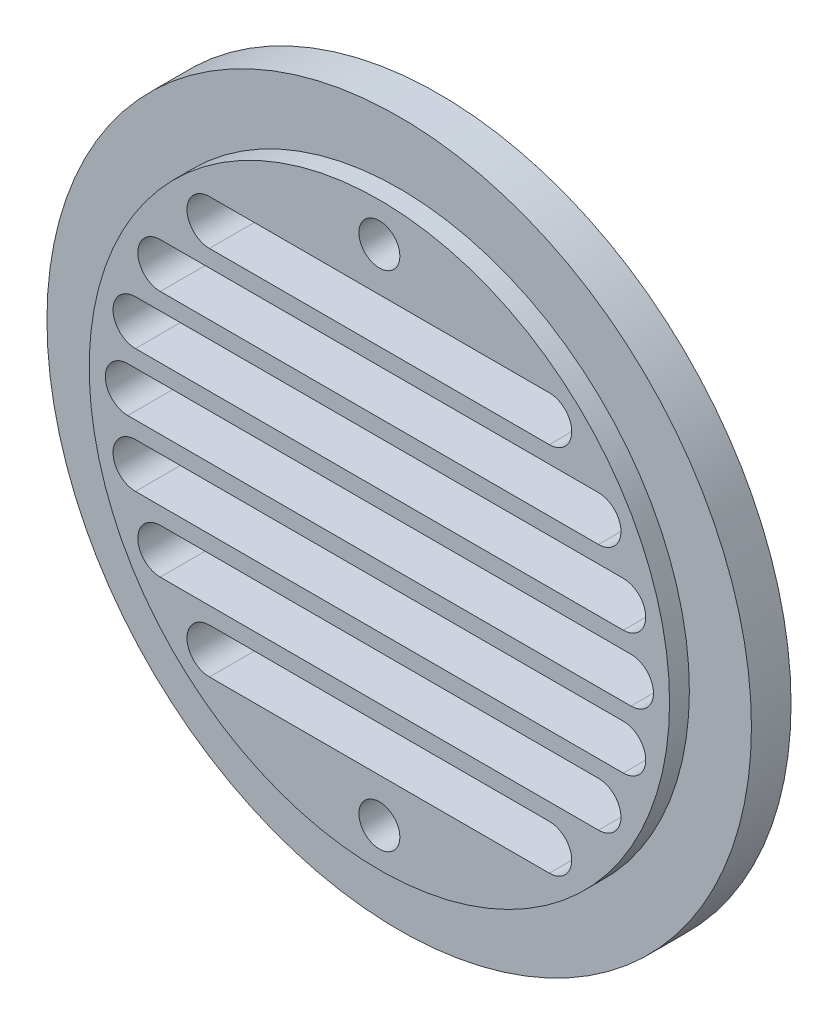
from build123d import *

# Parameters (mm, degrees)
SKETCH1_R           = 26.67
SKETCH1_R_2         = 21.971
SKETCH1_R_3         = 18.5
BOSS_EXTRUDE1_DEPTH = 3
SKETCH1_3_R         = 21.971
SKETCH1_3_R_2       = 18.5
BOSS_EXTRUDE2_DEPTH = 4.5
SKETCH2_R           = 1.55
CUT_EXTRUDE2_DEPTH  = 38.984573184


with BuildPart() as part:
    # Sketch1 → Boss-Extrude1 (new body)
    # profile 1 of 3: a face of its own
    with BuildSketch(Plane.XY):
        Circle(SKETCH1_R)
        Circle(SKETCH1_R_2, mode=Mode.SUBTRACT)
    # profile 2 of 3: a face of its own
    with BuildSketch(Plane.XY):
        Circle(SKETCH1_R_2)
        Circle(SKETCH1_R_3, mode=Mode.SUBTRACT)
    # profile 3 of 3: a face of its own
    with BuildSketch(Plane.XY):
        Circle(SKETCH1_R_3)
    extrude(amount=BOSS_EXTRUDE1_DEPTH)

    # Sketch1<3> → Boss-Extrude2 (add)
    # profile 1 of 2: a face of its own
    with BuildSketch(Plane.XY):
        Circle(SKETCH1_3_R)
        Circle(SKETCH1_3_R_2, mode=Mode.SUBTRACT)
    # profile 2 of 2: a face of its own
    with BuildSketch(Plane.XY):
        Circle(SKETCH1_3_R_2)
    extrude(amount=BOSS_EXTRUDE2_DEPTH)

    # Sketch2 → Cut-Extrude2 (cut, through all)
    with BuildSketch(Plane.XY.offset(4.5)):
        with Locations((0, 19.05)):
            Circle(SKETCH2_R)
        with Locations((0, -19.05)):
            Circle(SKETCH2_R)
        with BuildLine():
            Line((-12.86468033, 12.35), (12.86468033, 12.35))
            ThreePointArc((12.86468033, 12.35), (14.56468033, 14.05), (12.86468033, 15.75))
            Line((12.86468033, 15.75), (-12.86468033, 15.75))
            ThreePointArc((-12.86468033, 15.75), (-14.56468033, 14.05), (-12.86468033, 12.35))
        make_face()
        with BuildLine():
            Line((-16.588190244, 7.666666667), (16.588190244, 7.666666667))
            ThreePointArc((16.588190244, 7.666666667), (18.288190244, 9.366666667), (16.588190244, 11.066666667))
            Line((16.588190244, 11.066666667), (-16.588190244, 11.066666667))
            ThreePointArc((-16.588190244, 11.066666667), (-18.288190244, 9.366666667), (-16.588190244, 7.666666667))
        make_face()
        with BuildLine():
            Line((-18.465342913, 2.983333333), (18.465342913, 2.983333333))
            ThreePointArc((18.465342913, 2.983333333), (20.165342913, 4.683333333), (18.465342913, 6.383333333))
            Line((18.465342913, 6.383333333), (-18.465342913, 6.383333333))
            ThreePointArc((-18.465342913, 6.383333333), (-20.165342913, 4.683333333), (-18.465342913, 2.983333333))
        make_face()
        with BuildLine():
            Line((-19.05, -1.7), (19.05, -1.7))
            ThreePointArc((19.05, -1.7), (20.75, 0), (19.05, 1.7))
            Line((19.05, 1.7), (-19.05, 1.7))
            ThreePointArc((-19.05, 1.7), (-20.75, 0), (-19.05, -1.7))
        make_face()
        with BuildLine():
            Line((-18.465342913, -6.383333333), (18.465342913, -6.383333333))
            ThreePointArc((18.465342913, -6.383333333), (20.165342913, -4.683333333), (18.465342913, -2.983333333))
            Line((18.465342913, -2.983333333), (-18.465342913, -2.983333333))
            ThreePointArc((-18.465342913, -2.983333333), (-20.165342913, -4.683333333), (-18.465342913, -6.383333333))
        make_face()
        with BuildLine():
            Line((-16.588190244, -11.066666667), (16.588190244, -11.066666667))
            ThreePointArc((16.588190244, -11.066666667), (18.288190244, -9.366666667), (16.588190244, -7.666666667))
            Line((16.588190244, -7.666666667), (-16.588190244, -7.666666667))
            ThreePointArc((-16.588190244, -7.666666667), (-18.288190244, -9.366666667), (-16.588190244, -11.066666667))
        make_face()
        with BuildLine():
            Line((-12.86468033, -15.75), (12.86468033, -15.75))
            ThreePointArc((12.86468033, -15.75), (14.56468033, -14.05), (12.86468033, -12.35))
            Line((12.86468033, -12.35), (-12.86468033, -12.35))
            ThreePointArc((-12.86468033, -12.35), (-14.56468033, -14.05), (-12.86468033, -15.75))
        make_face()
    extrude(amount=-CUT_EXTRUDE2_DEPTH, mode=Mode.SUBTRACT)


solid = part.part
